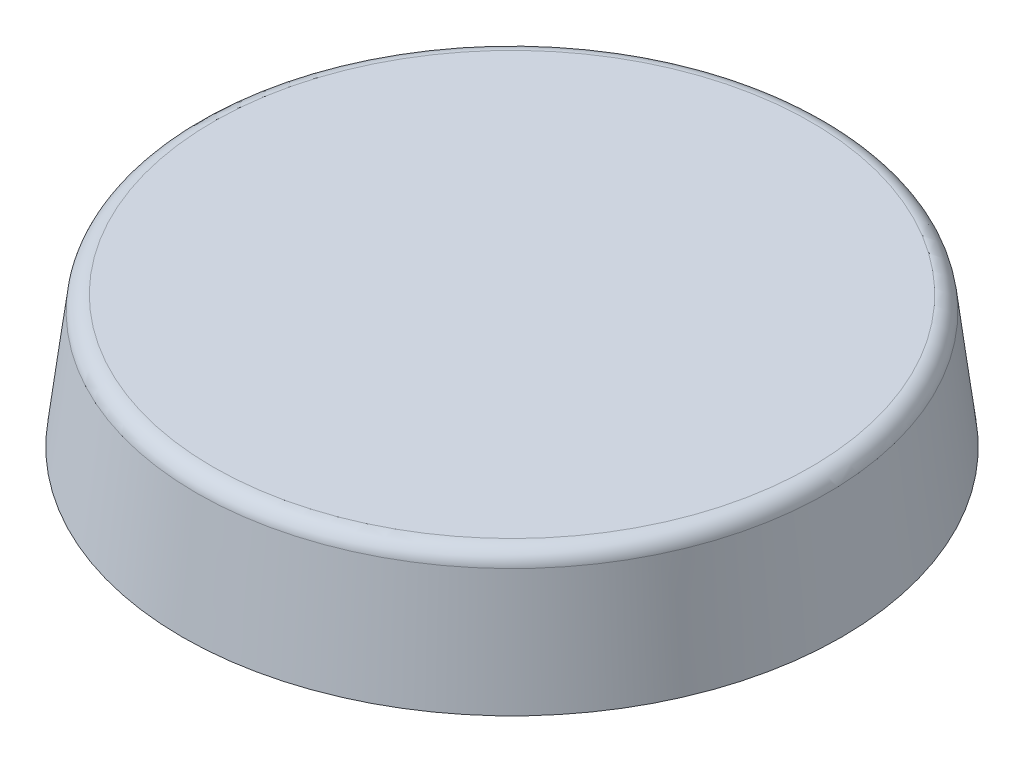
from build123d import *

# Parameters (mm, degrees)
SCHIZZO1_R                   = 10
ESTRUSIONE_ESTRUSIONE1_DEPTH = 4
ESTRUSIONE_ESTRUSIONE1_TAPER = 7
RACCORDO1_R                  = 0.5


with BuildPart() as part:
    # Schizzo1 → Estrusione-Estrusione1 (new body)
    with BuildSketch(Plane(origin=(0, 0, 0), x_dir=(1, 0, 0), z_dir=(0, 1, 0))):
        Circle(SCHIZZO1_R)
    extrude(amount=ESTRUSIONE_ESTRUSIONE1_DEPTH, taper=ESTRUSIONE_ESTRUSIONE1_TAPER)

    # Raccordo1
    raccordo1_edges = [part.edges().sort_by_distance(p)[0] for p in [
        (-9.508861756, 4, 0),
    ]]
    fillet(raccordo1_edges, radius=RACCORDO1_R)


solid = part.part
